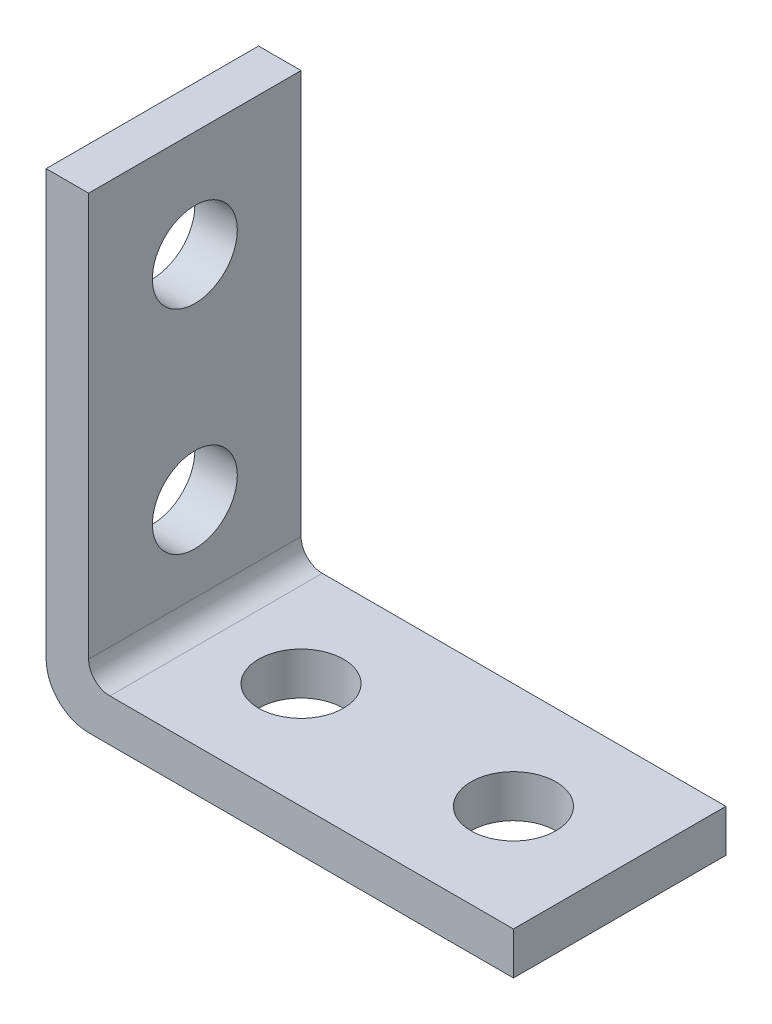
from build123d import *

# Parameters (mm, degrees)
SKETCH1_W           = 20
SKETCH1_H           = 10
BOSS_EXTRUDE1_DEPTH = 2
SKETCH2_W           = 10
SKETCH2_H           = 22
BOSS_EXTRUDE2_DEPTH = 2
FILLET1_R           = 2
FILLET2_R           = 1
SKETCH3_R           = 2
CUT_EXTRUDE1_DEPTH  = 2
SKETCH4_R           = 2
CUT_EXTRUDE2_DEPTH  = 2


with BuildPart() as part:
    # Sketch1 → Boss-Extrude1 (new body)
    with BuildSketch(Plane(origin=(0, 0, 0), x_dir=(1, 0, 0), z_dir=(0, 1, 0))):
        Rectangle(SKETCH1_W, SKETCH1_H)
    extrude(amount=BOSS_EXTRUDE1_DEPTH)

    # Sketch2 → Boss-Extrude2 (add)
    with BuildSketch(Plane.ZY.offset(10)):
        with Locations((0, 11)):
            Rectangle(SKETCH2_W, SKETCH2_H)
    extrude(amount=BOSS_EXTRUDE2_DEPTH)

    # Fillet1
    fillet1_edges = [part.edges().sort_by_distance(p)[0] for p in [
        (-12, 0, 0),
    ]]
    fillet(fillet1_edges, radius=FILLET1_R)

    # Fillet2
    fillet2_edges = [part.edges().sort_by_distance(p)[0] for p in [
        (-10, 2, 0),
    ]]
    fillet(fillet2_edges, radius=FILLET2_R)

    # Sketch3 → Cut-Extrude1 (cut)
    with BuildSketch(Plane(origin=(0, 2, 0), x_dir=(1, 0, 0), z_dir=(0, 1, 0))):
        with Locations((-5, 0)):
            Circle(SKETCH3_R)
        with Locations((5, 0)):
            Circle(SKETCH3_R)
    extrude(amount=-CUT_EXTRUDE1_DEPTH, mode=Mode.SUBTRACT)

    # Sketch4 → Cut-Extrude2 (cut)
    with BuildSketch(Plane(origin=(-10, 0, 0), x_dir=(0, 0, -1), z_dir=(1, 0, 0))):
        with Locations((0, 17)):
            Circle(SKETCH4_R)
        with Locations((0, 7)):
            Circle(SKETCH4_R)
    extrude(amount=-CUT_EXTRUDE2_DEPTH, mode=Mode.SUBTRACT)


solid = part.part
